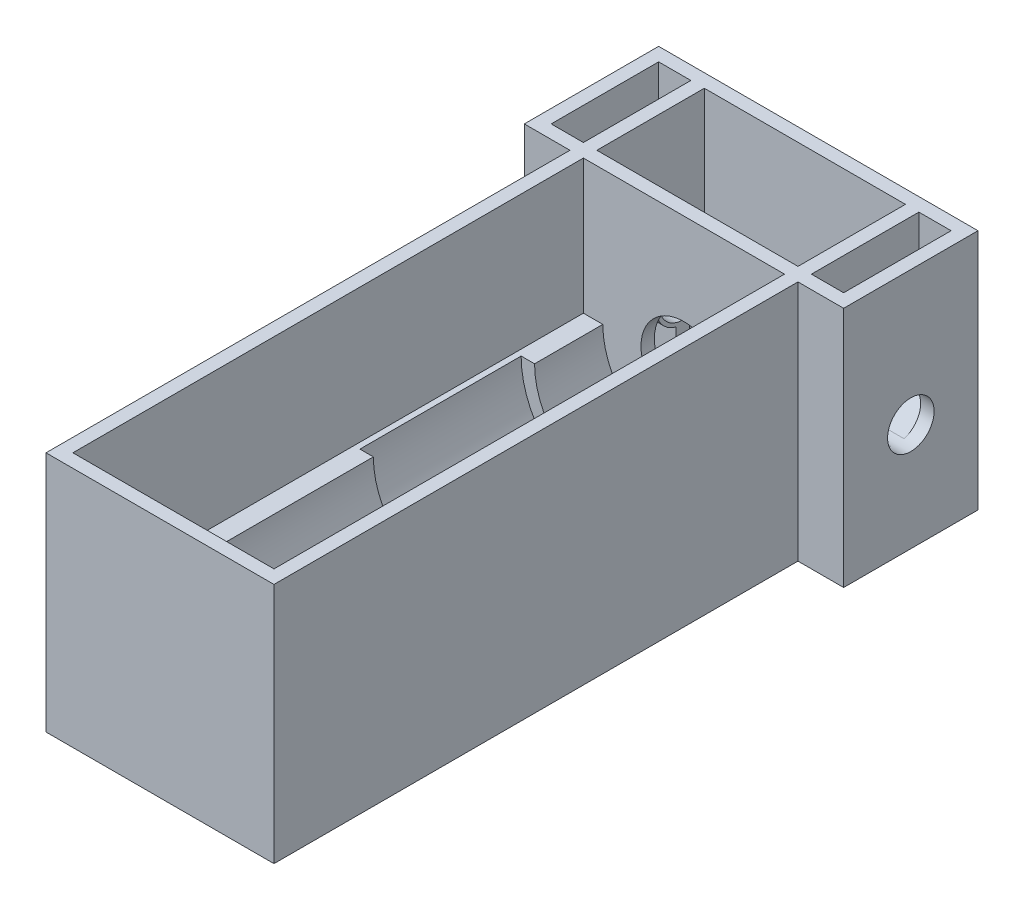
from build123d import *

# Parameters (mm, degrees)
BOSS_EXTRUDE1_DEPTH      = 12.7
SKETCH2_W                = 53.879496
SKETCH2_H                = 57.15
BOSS_EXTRUDE2_DEPTH      = 3.175
CUT_EXTRUDE2_DEPTH       = 66.145131417
CUT_EXTRUDE2_DEPTH_BACK  = 66.145131417
SKETCH3_R                = 5.5
SKETCH5_W                = 53.879496
SKETCH5_H                = 25.4
SKETCH5_R                = 3.4925
BOSS_EXTRUDE3_DEPTH      = 6.35
SKETCH7_W                = 7.62
SKETCH7_H                = 15.609396712
BOSS_EXTRUDE7_DEPTH      = 1.5875
SKETCH8_W                = 53.879496
SKETCH8_H                = 57.15
BOSS_EXTRUDE8_DEPTH      = 127
CUT_EXTRUDE7_DEPTH       = 154.323065852
CUT_EXTRUDE7_DEPTH_BACK  = 154.323065852
SKETCH13_W               = 0.002356984
SKETCH13_H               = 124.229061331
CUT_EXTRUDE8_START       = -31.75
SKETCH14_W               = 47.527139016
SKETCH14_H               = 120.65
CUT_EXTRUDE8_DEPTH       = 31.75
CUT_EXTRUDE9_DEPTH       = 4.229066359
SKETCH16_W               = 53.879496
SKETCH16_H               = 25.4
CUT_EXTRUDE10_DEPTH      = 152.071109158
SKETCH18_W               = 13.97
SKETCH18_H               = 31.75
SKETCH18_W_2             = 7.62
SKETCH18_H_2             = 25.4
BOSS_EXTRUDE10_DEPTH     = 57.15
BOSS_EXTRUDE11_START     = -34.559748
BOSS_EXTRUDE11_DEPTH     = 7.62
BOSS_EXTRUDE12_START     = 26.939748
BOSS_EXTRUDE12_DEPTH     = 7.62
CUT_EXTRUDE11_DEPTH      = 163.985890519
CUT_EXTRUDE11_DEPTH_BACK = 163.985890519
SKETCH20_R               = 5.5


with BuildPart() as part:
    # Sketch1 → Boss-Extrude1 (new, symmetric)
    with BuildSketch(Plane.XY):
        Polygon((-26.939748, 0), (26.939748, 0), (26.939748, 6.35), (26.939748, 57.15), (23.764748, 57.15), (23.764748, 6.35), (-23.764748, 6.35), (-23.764748, 57.15), (-26.939748, 57.15), (-26.939748, 6.35), align=None)
    extrude(amount=BOSS_EXTRUDE1_DEPTH, both=True)

    # Sketch2 → Boss-Extrude2 (add)
    with BuildSketch(Plane(origin=(0, 0, -12.7), x_dir=(-1, 0, 0), z_dir=(0, 0, -1))):
        with Locations((0, 28.575)):
            Rectangle(SKETCH2_W, SKETCH2_H)
    extrude(amount=BOSS_EXTRUDE2_DEPTH)

    # Sketch6 → Revolve2 (revolve)
    with BuildSketch(Plane.XY, mode=Mode.PRIVATE) as revolve2_sk:
        Polygon((-23.764748, 25.4), (-16.144748, 25.4), (-16.144748, 31.75), (-21.224748, 31.75), (-23.764748, 33.02), align=None)
        Polygon((23.764748, 33.02), (23.764748, 25.4), (16.144748, 25.4), (16.144748, 31.75), (21.224748, 31.75), align=None)
    revolve(revolve2_sk.sketch.rotate(Axis((-23.764748, 25.4, 0), (1, 0, 0)), 90), axis=Axis((-23.764748, 25.4, 0), (1, 0, 0)))

    # Sketch3 → Cut-Extrude2 (cut, two sides: drawn at the far end of the back side and taken through both)
    with BuildSketch(Plane(origin=(0, 0, 0), x_dir=(0, 0, -1), z_dir=(1, 0, 0)).offset(-CUT_EXTRUDE2_DEPTH_BACK)):
        with Locations((0, 25.4)):
            Circle(SKETCH3_R)
    extrude(amount=CUT_EXTRUDE2_DEPTH + CUT_EXTRUDE2_DEPTH_BACK, mode=Mode.SUBTRACT)

    # Sketch5 → Boss-Extrude3 (add)
    with BuildSketch(Plane.XZ):
        with Locations((0, -28.575)):
            Rectangle(SKETCH5_W, SKETCH5_H)
        with Locations(Location((7.889748, -28.575, 0), (0, 0, 270))):
            Circle(SKETCH5_R, mode=Mode.SUBTRACT)
        with Locations(Location((-17.510252, -28.575, 0), (0, 0, 270))):
            Circle(SKETCH5_R, mode=Mode.SUBTRACT)
    extrude(amount=-BOSS_EXTRUDE3_DEPTH)

    # Sketch7 → Boss-Extrude7 (add, symmetric)
    with BuildSketch(Plane.XY):
        with Locations((-19.954748, 14.154698356)):
            Rectangle(SKETCH7_W, SKETCH7_H)
        with Locations((19.954748, 14.154698356)):
            Rectangle(SKETCH7_W, SKETCH7_H)
    extrude(amount=BOSS_EXTRUDE7_DEPTH, both=True)

    # Sketch8 → Boss-Extrude8 (add)
    with BuildSketch(Plane.XY.offset(12.7)):
        with Locations((0, 28.575)):
            Rectangle(SKETCH8_W, SKETCH8_H)
    extrude(amount=BOSS_EXTRUDE8_DEPTH)

    # Sketch9 → Cut-Revolve1 (revolve, cut)
    with BuildSketch(Plane(origin=(0, 0, 0), x_dir=(0, 0, -1), z_dir=(1, 0, 0))):
        Polygon((-70.104, 47.752), (-70.104, 44.577), (-136.525, 44.577), (-136.525, 25.4), (-70.104, 25.4), (0, 25.4), (0, 35.56), (-20.104066359, 35.56), (-20.104066359, 44.577), (-32.004, 44.577), (-32.004, 47.752), align=None)
    revolve(axis=Axis((0, 25.4, 0), (0, 0, 1)), mode=Mode.SUBTRACT)

    # Sketch13 → Cut-Extrude7 (cut, two sides: drawn at the far end of the back side and taken through both)
    with BuildSketch(Plane(origin=(0, 0, 0), x_dir=(-1, 0, 0), z_dir=(0, -1, 0)).offset(-CUT_EXTRUDE7_DEPTH_BACK)):
        with Locations((26.940926492, -77.585469335)):
            Rectangle(SKETCH13_W, SKETCH13_H)
        with Locations((-26.938569508, -77.585469335)):
            Rectangle(SKETCH13_W, SKETCH13_H)
    extrude(amount=CUT_EXTRUDE7_DEPTH + CUT_EXTRUDE7_DEPTH_BACK, mode=Mode.SUBTRACT)

    # Sketch14 → Cut-Extrude8 (cut)
    with BuildSketch(Plane(origin=(0, 57.15, 0), x_dir=(1, 0, 0), z_dir=(0, 1, 0)).offset(CUT_EXTRUDE8_START)):
        with Locations((-0.001178492, -76.2)):
            Rectangle(SKETCH14_W, SKETCH14_H)
    extrude(amount=CUT_EXTRUDE8_DEPTH, mode=Mode.SUBTRACT)

    # Sketch15 → Cut-Extrude9 (cut)
    with BuildSketch(Plane.XY.offset(20.104066359)):
        with BuildLine():
            Line((-10.16, 25.4), (-19.177, 25.4))
            ThreePointArc((-19.177, 25.4), (0, 6.223), (19.177, 25.4))
            Line((19.177, 25.4), (10.16, 25.4))
            ThreePointArc((10.16, 25.4), (0, 15.24), (-10.16, 25.4))
        make_face()
    extrude(amount=-CUT_EXTRUDE9_DEPTH, mode=Mode.SUBTRACT)

    # Sketch16 → Cut-Extrude10 (cut, through all)
    with BuildSketch(Plane(origin=(0, 6.35, 0), x_dir=(1, 0, 0), z_dir=(0, 1, 0))):
        with Locations((0, 28.575)):
            Rectangle(SKETCH16_W, SKETCH16_H)
    extrude(amount=-CUT_EXTRUDE10_DEPTH, mode=Mode.SUBTRACT)

    # Sketch18 → Boss-Extrude10 (add)
    with BuildSketch(Plane(origin=(0, 0, 0), x_dir=(1, 0, 0), z_dir=(0, 1, 0))):
        with Locations((-30.749748, 0)):
            Rectangle(SKETCH18_W, SKETCH18_H)
        with Locations((-30.749748, 0)):
            Rectangle(SKETCH18_W_2, SKETCH18_H_2, mode=Mode.SUBTRACT)
    boss_extrude10 = extrude(amount=BOSS_EXTRUDE10_DEPTH)

    # Sketch19 → Boss-Extrude11 (add)
    with BuildSketch(Plane(origin=(0, 0, 0), x_dir=(0, 0, -1), z_dir=(1, 0, 0)).offset(BOSS_EXTRUDE11_START)):
        with BuildLine():
            Line((1.5875, 20.134086618), (12.7, 23.484140534))
            Line((12.7, 23.484140534), (12.7, 0))
            Line((12.7, 0), (-12.7, 0))
            Line((-12.7, 0), (-12.7, 23.484140534))
            Line((-12.7, 23.484140534), (-1.5875, 20.134086618))
            ThreePointArc((-1.5875, 20.134086618), (0, 19.9), (1.5875, 20.134086618))
        make_face()
    extrude(amount=BOSS_EXTRUDE11_DEPTH)

    # Mirror4: Boss-Extrude10 across plane
    add(boss_extrude10.mirror(Plane(origin=(0, 0, 0), x_dir=(0, 0, 1), z_dir=(1, 0, 0))))

    # Sketch19<2> → Boss-Extrude12 (add)
    with BuildSketch(Plane(origin=(0, 0, 0), x_dir=(0, 0, -1), z_dir=(1, 0, 0)).offset(BOSS_EXTRUDE12_START)):
        with BuildLine():
            Line((1.5875, 20.134086618), (12.7, 23.484140534))
            Line((12.7, 23.484140534), (12.7, 0))
            Line((12.7, 0), (-12.7, 0))
            Line((-12.7, 0), (-12.7, 23.484140534))
            Line((-12.7, 23.484140534), (-1.5875, 20.134086618))
            ThreePointArc((-1.5875, 20.134086618), (0, 19.9), (1.5875, 20.134086618))
        make_face()
    extrude(amount=BOSS_EXTRUDE12_DEPTH)

    # Sketch20 → Cut-Extrude11 (cut, two sides: drawn at the far end of the back side and taken through both)
    with BuildSketch(Plane(origin=(-23.764748, 0, 0), x_dir=(0, 0, -1), z_dir=(1, 0, 0)).offset(-CUT_EXTRUDE11_DEPTH_BACK)):
        with Locations((0, 25.4)):
            Circle(SKETCH20_R)
    extrude(amount=CUT_EXTRUDE11_DEPTH + CUT_EXTRUDE11_DEPTH_BACK, mode=Mode.SUBTRACT)


solid = part.part
